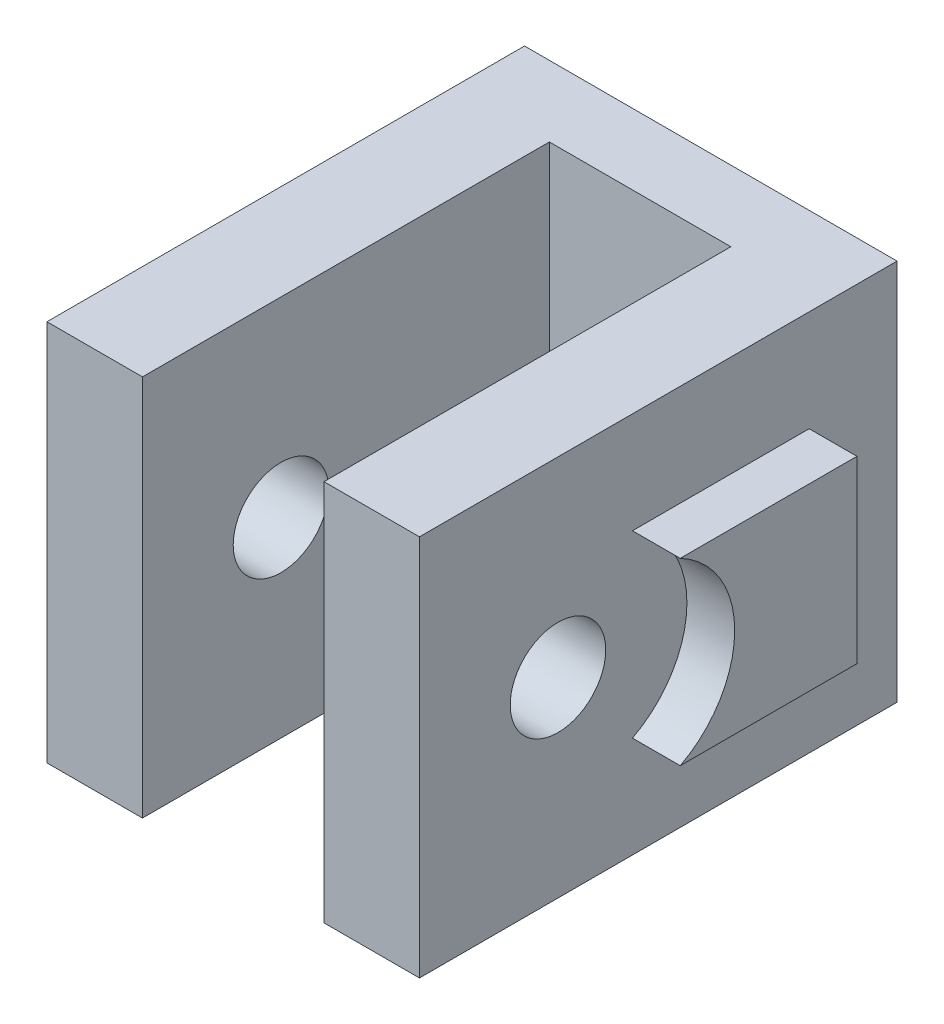
from build123d import *

# Parameters (mm, degrees)
BOSS_EXTRUDE1_DEPTH = 20
M5_TAPPED_HOLE1_D   = 4.2
SKETCH5_R           = 2.5
CUT_EXTRUDE1_DEPTH  = 38.486664295
BOSS_EXTRUDE2_DEPTH = 2.5


with BuildPart() as part:
    # Sketch1 → Boss-Extrude1 (new body)
    with BuildSketch(Plane(origin=(0, 0, 0), x_dir=(1, 0, 0), z_dir=(0, 1, 0))):
        Polygon((14.5, -25), (19.5, -25), (19.5, 0), (0, 0), (0, -25), (5, -25), (5, -3.7), (14.5, -3.7), align=None)
    extrude(amount=BOSS_EXTRUDE1_DEPTH)

    # M5 Tapped Hole1 (through all)
    with Locations(Plane(origin=(0, 0, 0), x_dir=(-1, 0, 0), z_dir=(0, 0, -1))):
        with Locations((-9.75, 10)):
            Hole(M5_TAPPED_HOLE1_D / 2)

    # Sketch5 → Cut-Extrude1 (cut, through all)
    with BuildSketch(Plane(origin=(19.5, 0, 0), x_dir=(0, 0, -1), z_dir=(1, 0, 0))):
        with Locations((-17.75, 10)):
            Circle(SKETCH5_R)
    extrude(amount=-CUT_EXTRUDE1_DEPTH, mode=Mode.SUBTRACT)

    # Sketch6 → Boss-Extrude2 (add)
    with BuildSketch(Plane(origin=(19.5, 0, 0), x_dir=(0, 0, -1), z_dir=(1, 0, 0))):
        with BuildLine():
            Line((-13.85, 14.7), (-4.6, 14.7))
            Line((-4.6, 14.7), (-4.6, 5.3))
            Line((-4.6, 5.3), (-13.85, 5.3))
            ThreePointArc((-13.85, 5.3), (-10.999489743, 10), (-13.85, 14.7))
        make_face()
    boss_extrude2 = extrude(amount=BOSS_EXTRUDE2_DEPTH)

    # Mirror1: Boss-Extrude2 across plane
    add(boss_extrude2.mirror(Plane(origin=(9.75, 0, 0), x_dir=(0, 0, 1), z_dir=(1, 0, 0))))


solid = part.part
